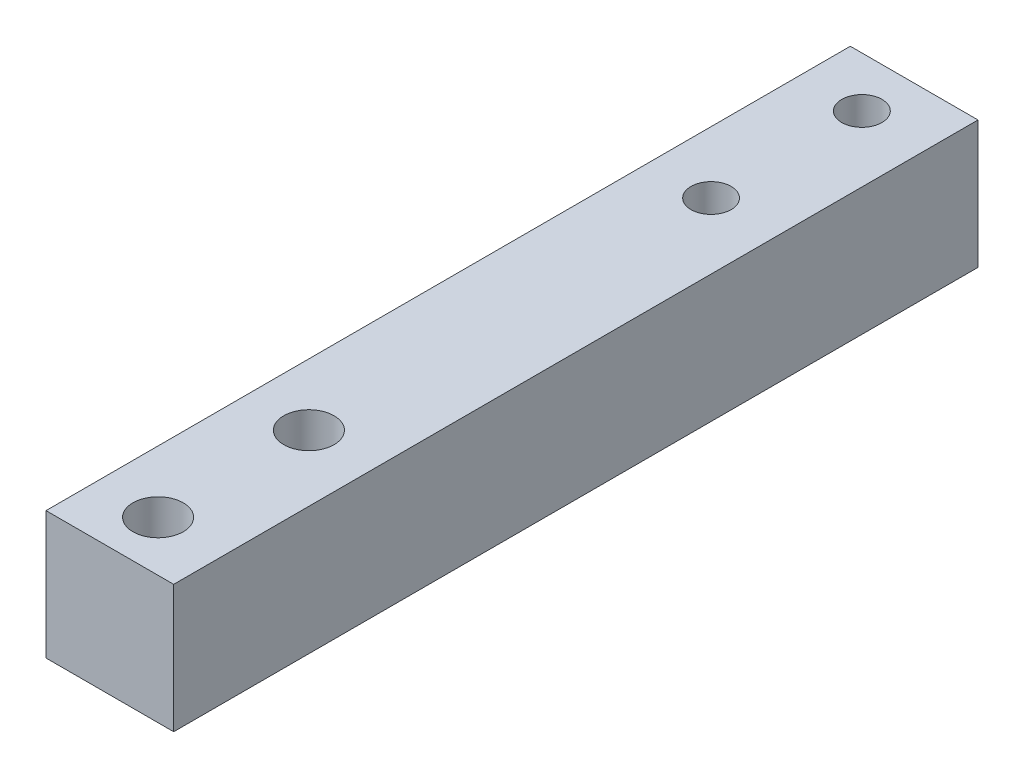
from build123d import *

# Parameters (mm, degrees)
SZKIC1_W                    = 12.7
SZKIC1_H                    = 80
DODANIE_WYCI_GNI_CIE1_DEPTH = 12.7
SZKIC2_R                    = 2
SZKIC2_R_2                  = 2.5
WYTNIJ_WYCI_GNI_CIE1_DEPTH  = 12.7


with BuildPart() as part:
    # Szkic1 → Dodanie-wyciągnięcie1 (new body)
    with BuildSketch(Plane(origin=(0, -32.273993717, 0), x_dir=(1, 0, 0), z_dir=(0, 1, 0))):
        with Locations((-268.792181953, 88.157477818)):
            Rectangle(SZKIC1_W, SZKIC1_H)
    extrude(amount=-DODANIE_WYCI_GNI_CIE1_DEPTH)

    # Szkic2 → Wytnij-wyciągnięcie1 (cut)
    with BuildSketch(Plane(origin=(0, -44.973993717, 0), x_dir=(-1, 0, 0), z_dir=(0, -1, 0))):
        with Locations(Location((268.992578516, 123.157477818, 0), (0, 0, 180))):
            Circle(SZKIC2_R)
        with Locations(Location((268.992578516, 108.157477818, 0), (0, 0, 180))):
            Circle(SZKIC2_R)
        with Locations(Location((268.992578516, 53.157477818, 0), (0, 0, 180))):
            Circle(SZKIC2_R_2)
        with Locations(Location((268.992578516, 68.157477818, 0), (0, 0, 180))):
            Circle(SZKIC2_R_2)
    extrude(amount=-WYTNIJ_WYCI_GNI_CIE1_DEPTH, mode=Mode.SUBTRACT)


solid = part.part
